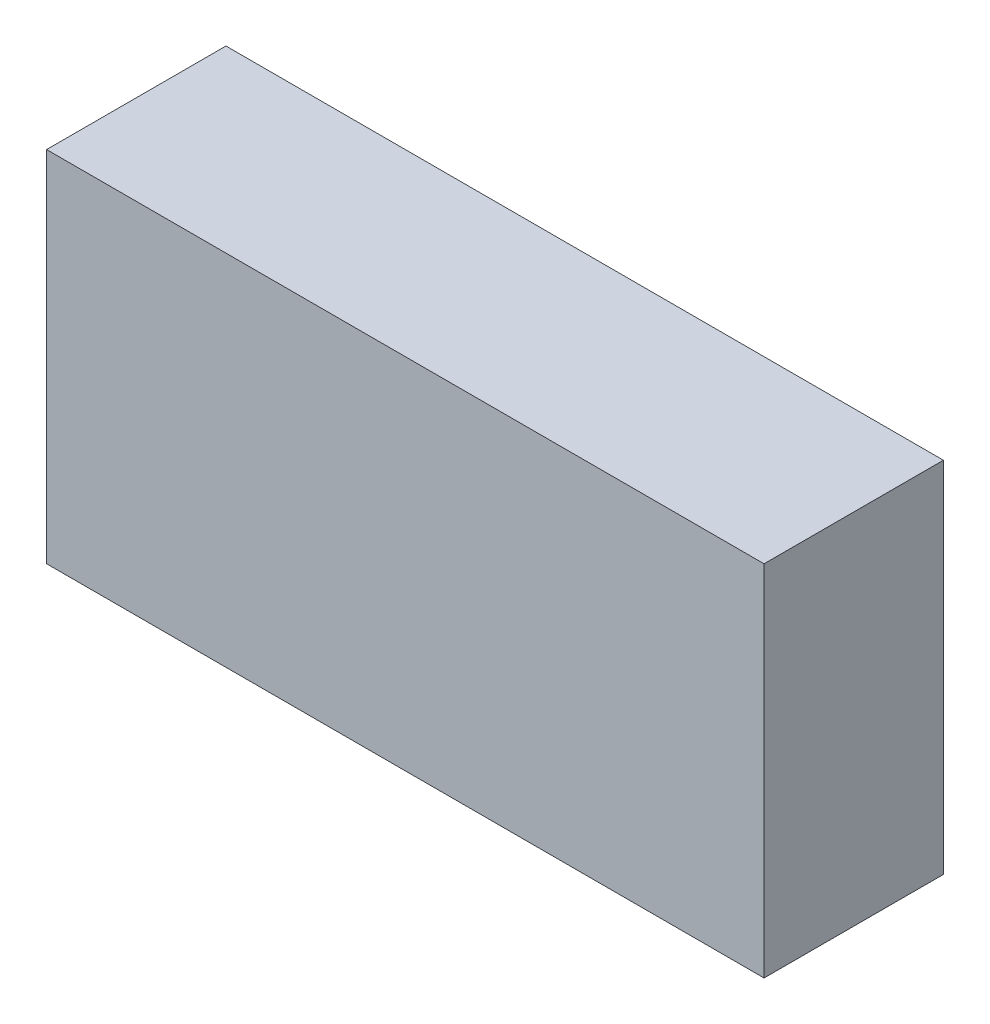
from build123d import *

# Parameters (mm, degrees)
SKETCH1_W           = 40
SKETCH1_H           = 20
BOSS_EXTRUDE1_DEPTH = 10


with BuildPart() as part:
    # Sketch1 → Boss-Extrude1 (new body)
    with BuildSketch(Plane.XY):
        Rectangle(SKETCH1_W, SKETCH1_H)
    extrude(amount=BOSS_EXTRUDE1_DEPTH)


solid = part.part
